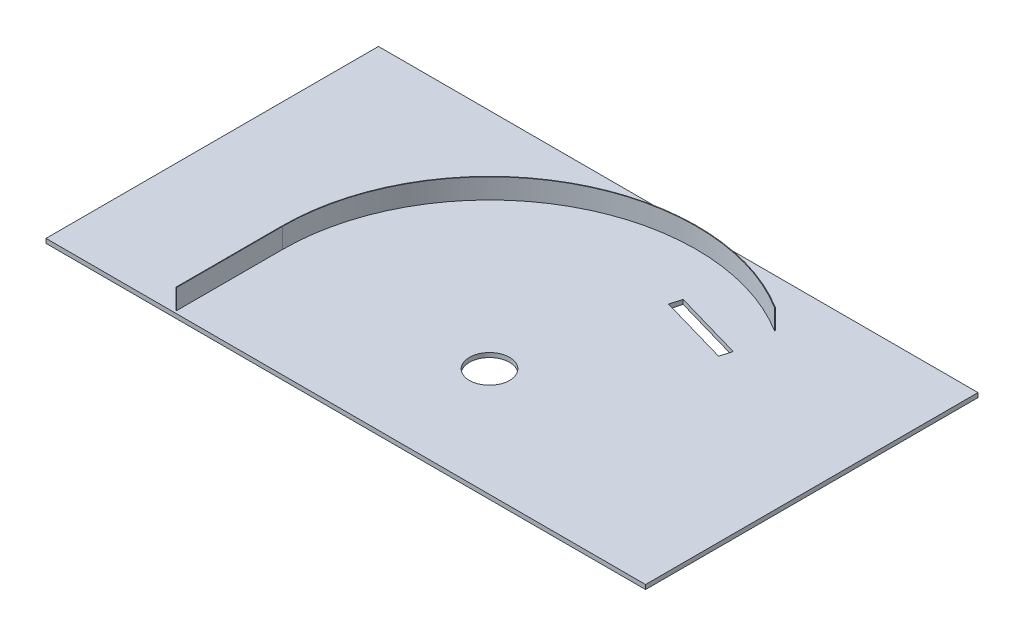
from build123d import *

# Parameters (mm, degrees)
BOSS_EXTRUDE1_DEPTH    = 50.8
SKETCH4_W              = 1518.677694458
SKETCH4_H              = 842.1
BOSS_EXTRUDE2_DEPTH    = 11.1125
F_20_0MM_DOWEL_HOLE1_D = 101.6
SKETCH8_W              = 1.5875
SKETCH8_H              = 50.8
BOSS_EXTRUDE3_DEPTH    = 269.05
CUT_EXTRUDE1_DEPTH     = 1022.192210115


with BuildPart() as part:
    # Sketch3 → Boss-Extrude1 (new body)
    with BuildSketch(Plane(origin=(0, 0, 0), x_dir=(1, 0, 0), z_dir=(0, 1, 0))):
        with BuildLine():
            Line((-524, 0), (-525.5875, 0))
            ThreePointArc((-525.5875, 0), (-255.243310314, 459.448661655), (277.677694458, 446.248045549))
            Line((277.677694458, 446.248045549), (277.677694458, 444.377202386))
            ThreePointArc((277.677694458, 444.377202386), (-254.040241009, 458.300726541), (-524, 0))
        make_face()
    extrude(amount=BOSS_EXTRUDE1_DEPTH)

    # Sketch4 → Boss-Extrude2 (add)
    with BuildSketch(Plane(origin=(0, 0, 0), x_dir=(1, 0, 0), z_dir=(0, 1, 0))):
        with Locations((-88.661152771, 145.65)):
            Rectangle(SKETCH4_W, SKETCH4_H)
    extrude(amount=-BOSS_EXTRUDE2_DEPTH)

    # Ø20.0mm Dowel Hole1 (through all)
    with Locations(Plane(origin=(0, 0, 0), x_dir=(1, 0, 0), z_dir=(0, 1, 0))):
        with Locations((0, 0)):
            Hole(F_20_0MM_DOWEL_HOLE1_D / 2)

    # Sketch8 → Boss-Extrude3 (add)
    with BuildSketch(Plane.XY):
        with Locations((-524.79375, 25.4)):
            Rectangle(SKETCH8_W, SKETCH8_H)
    extrude(amount=BOSS_EXTRUDE3_DEPTH)

    # Sketch9 → Cut-Extrude1 (cut, through all)
    with BuildSketch(Plane(origin=(0, 0, 0), x_dir=(1, 0, 0), z_dir=(0, 1, 0))):
        Polygon((270.669120675, 346.737850878), (92.835706926, 397.730761704), (84.566586251, 368.892910826), (262.4, 317.9), align=None)
    extrude(amount=-CUT_EXTRUDE1_DEPTH, mode=Mode.SUBTRACT)


solid = part.part
